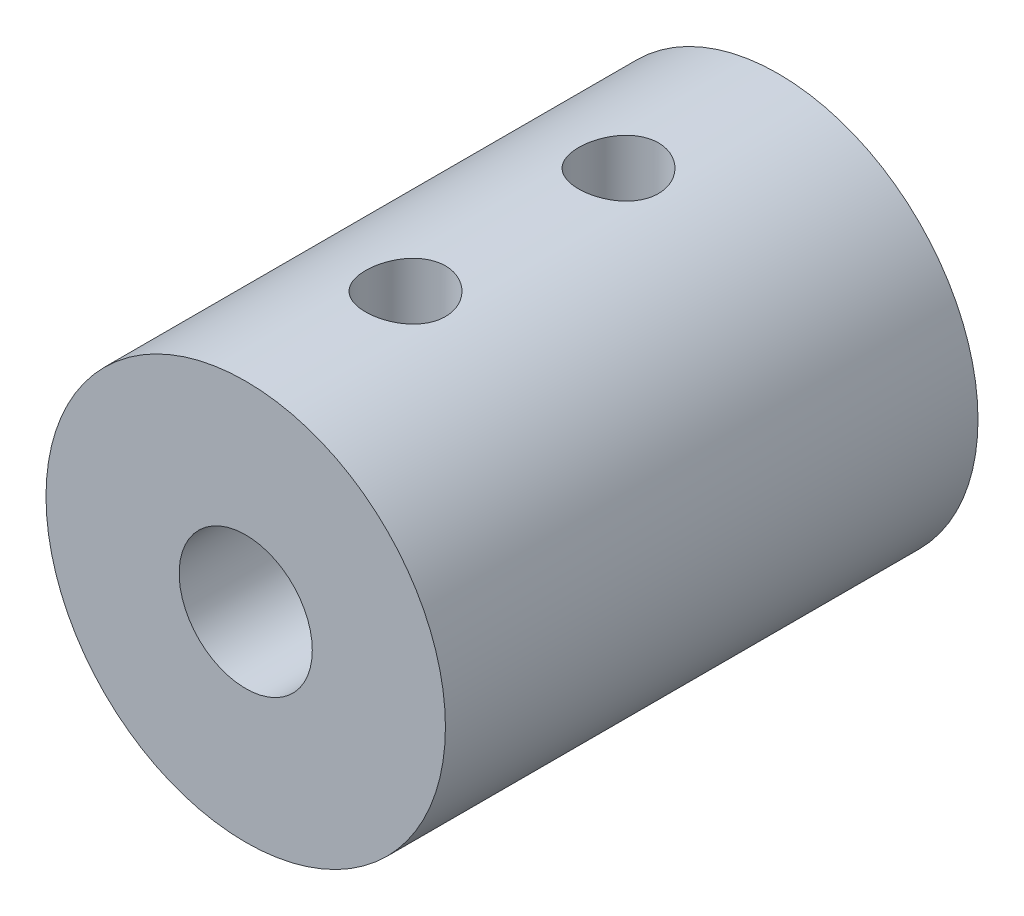
from build123d import *

# Parameters (mm, degrees)
SKETCH_1_R               = 7.5
SKETCH_1_R_2             = 2.5
EXTRUDE_1_DEPTH          = 20
CUT_EXTRUDE_1_DEPTH      = 20
CUT_EXTRUDE_1_DEPTH_BACK = 20
SKETCH_2_R               = 1.5


with BuildPart() as part:
    # Эскиз1 → Бобышка-Вытянуть1 (new body)
    with BuildSketch(Plane.XY):
        Circle(SKETCH_1_R)
        Circle(SKETCH_1_R_2, mode=Mode.SUBTRACT)
    extrude(amount=EXTRUDE_1_DEPTH)

    # Эскиз2 → Вырез-Вытянуть1 (cut, two sides: drawn at the far end of the back side and taken through both)
    with BuildSketch(Plane(origin=(0, 0, 0), x_dir=(1, 0, 0), z_dir=(0, 1, 0)).offset(-CUT_EXTRUDE_1_DEPTH_BACK)):
        with Locations((0, -6)):
            Circle(SKETCH_2_R)
        with Locations((0, -14)):
            Circle(SKETCH_2_R)
    extrude(amount=CUT_EXTRUDE_1_DEPTH + CUT_EXTRUDE_1_DEPTH_BACK, mode=Mode.SUBTRACT)


solid = part.part
